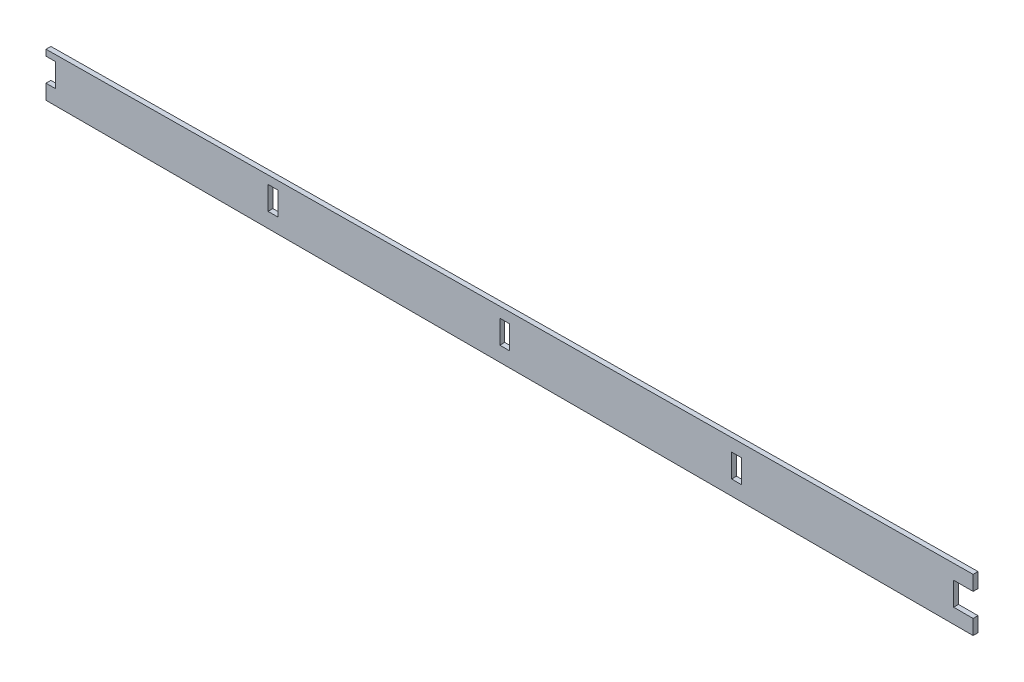
from build123d import *

# Parameters (mm, degrees)
SKETCH1_W           = 3.175
SKETCH1_H           = 7.62
BOSS_EXTRUDE1_DEPTH = 1.5875


with BuildPart() as part:
    # Sketch1 → Boss-Extrude1 (new body)
    with BuildSketch(Plane.XY):
        Polygon((88.325743431, 32.627583915), (81.975743431, 32.627583915), (81.975743431, 25.007583915), (88.325743431, 25.007583915), (88.325743431, 20.168652164), (-213.934256569, 20.168652164), (-213.934256569, 25.007583915), (-210.759256569, 25.007583915), (-210.759256569, 32.627583915), (-213.934256569, 32.627583915), (-213.934256569, 34.595942438), (88.325743431, 37.466479476), align=None)
        with Locations((-139.956756569, 28.817583915)):
            Rectangle(SKETCH1_W, SKETCH1_H, mode=Mode.SUBTRACT)
        with Locations((-64.391756569, 28.817583915)):
            Rectangle(SKETCH1_W, SKETCH1_H, mode=Mode.SUBTRACT)
        with Locations((11.173243431, 28.817583915)):
            Rectangle(SKETCH1_W, SKETCH1_H, mode=Mode.SUBTRACT)
    extrude(amount=BOSS_EXTRUDE1_DEPTH)


solid = part.part
